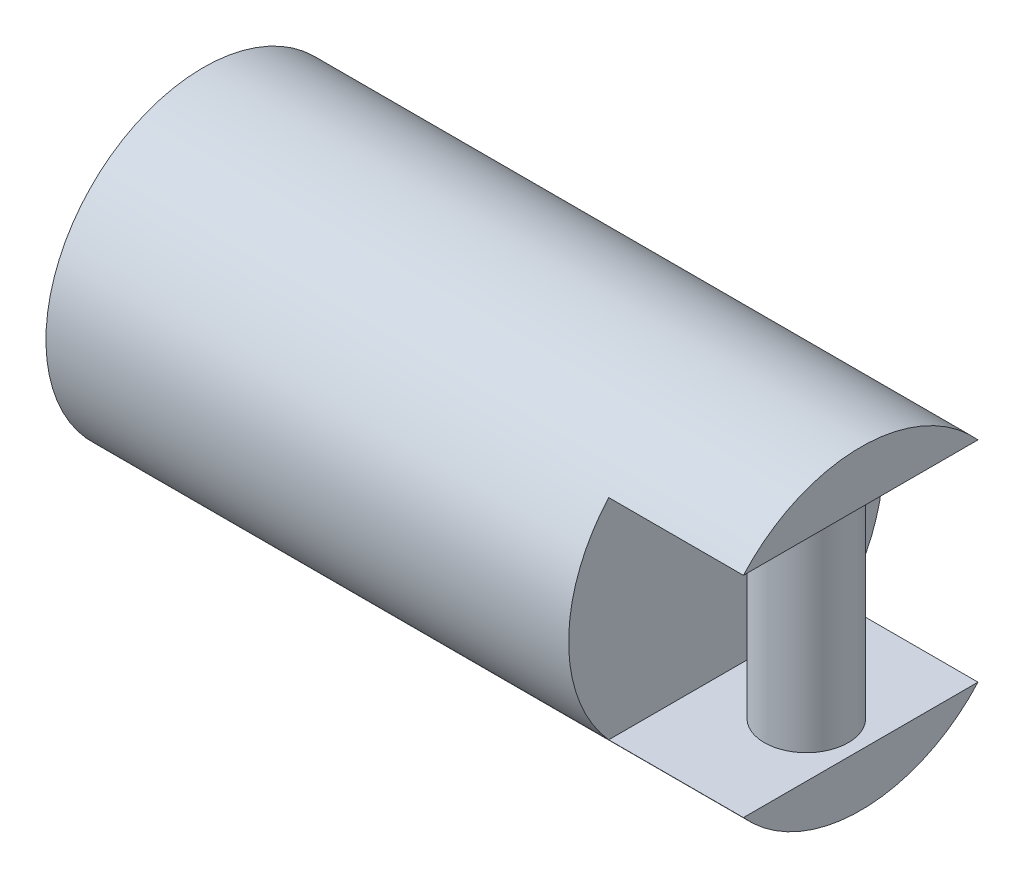
from build123d import *

# Parameters (mm, degrees)
SKETCH_2_R               = 22.5
EXTRUDE_1_DEPTH          = 94
CUT_EXTRUDE_1_DEPTH      = 53
CUT_EXTRUDE_1_DEPTH_BACK = 53
SKETCH_3_W               = 19.263131719
SKETCH_3_H               = 15
EXTRUDE_3_DEPTH          = 16
EXTRUDE_3_DEPTH_BACK     = 19


with BuildPart() as part:
    # 草图2 → 凸台-拉伸1 (new body)
    with BuildSketch(Plane(origin=(0, 0, 0), x_dir=(0, 0, -1), z_dir=(1, 0, 0))):
        Circle(SKETCH_2_R)
    extrude(amount=EXTRUDE_1_DEPTH)

    # 草图3 → 切除-拉伸1 (cut, two sides: drawn at the far end of the back side and taken through both)
    with BuildSketch(Plane.XY.offset(-CUT_EXTRUDE_1_DEPTH_BACK)):
        with Locations((84.36843414, 7.5)):
            Rectangle(SKETCH_3_W, SKETCH_3_H)
        with Locations((84.36843414, -7.5)):
            Rectangle(SKETCH_3_W, SKETCH_3_H)
    extrude(amount=CUT_EXTRUDE_1_DEPTH + CUT_EXTRUDE_1_DEPTH_BACK, mode=Mode.SUBTRACT)

    # 草图4 → 凸台-拉伸3 (add, two sides: drawn at the far end of the back side and taken through both)
    with BuildSketch(Plane(origin=(0, 0, 0), x_dir=(1, 0, 0), z_dir=(0, 1, 0)).offset(-EXTRUDE_3_DEPTH_BACK)):
        with BuildLine():
            ThreePointArc((92.224417763, 0), (86.224417763, 6), (80.224417763, 0))
            Line((80.224417763, 0), (92.224417763, 0))
        make_face()
        with BuildLine():
            Line((92.224417763, 0), (80.224417763, 0))
            ThreePointArc((80.224417763, 0), (86.224417763, -6), (92.224417763, 0))
        make_face()
    extrude(amount=EXTRUDE_3_DEPTH + EXTRUDE_3_DEPTH_BACK)


solid = part.part
